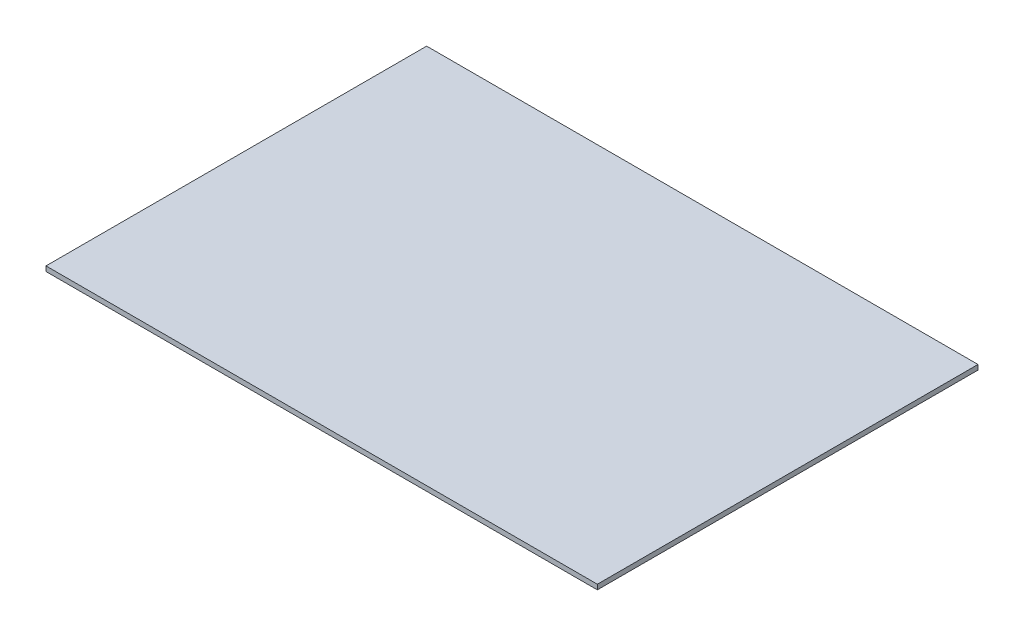
from build123d import *

# Parameters (mm, degrees)
SKETCH1_W      = 281
SKETCH1_H      = 194
EXTRUDE1_DEPTH = 2.5


with BuildPart() as part:
    # Sketch1 → Extrude1 (new body)
    with BuildSketch(Plane(origin=(0, 0, 0), x_dir=(1, 0, 0), z_dir=(0, 1, 0))):
        Rectangle(SKETCH1_W, SKETCH1_H)
    extrude(amount=EXTRUDE1_DEPTH)


solid = part.part
